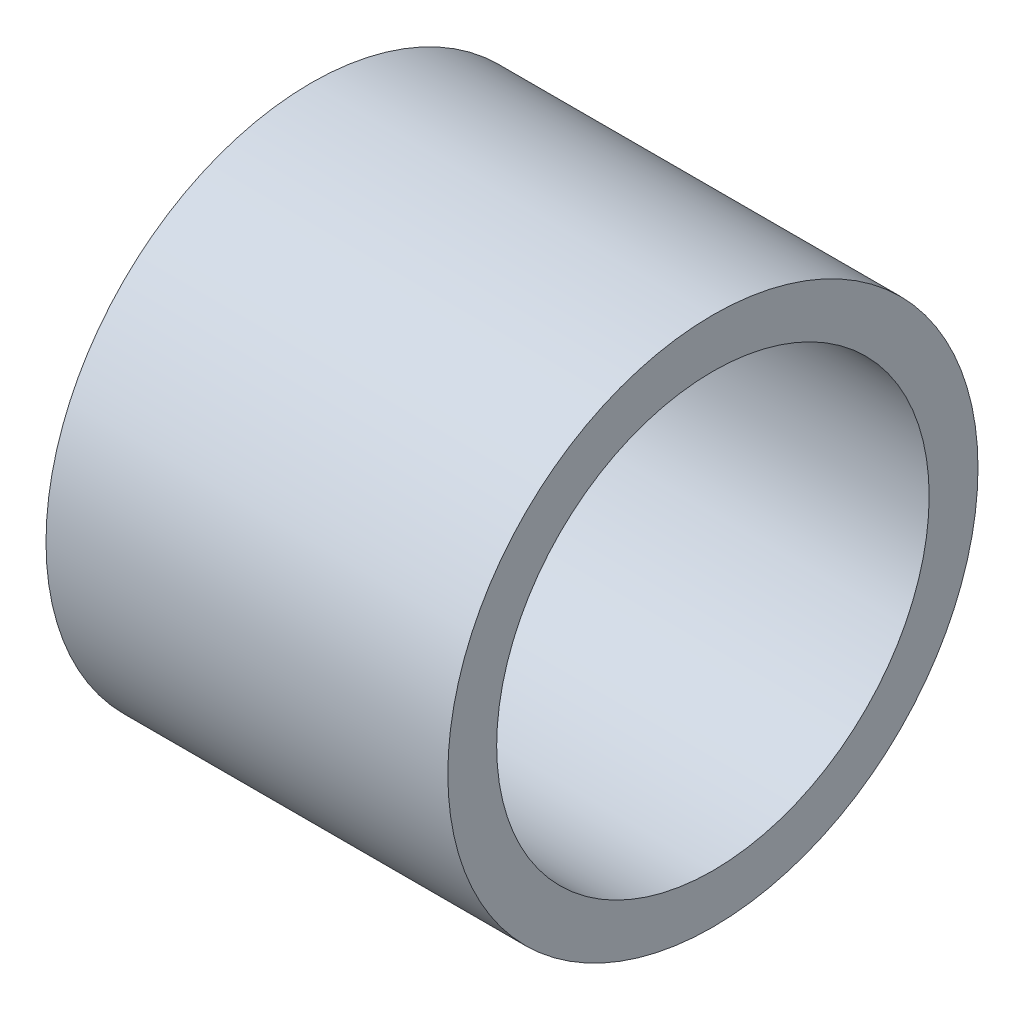
from build123d import *

# Parameters (mm, degrees)
SKETCH1_R           = 9.5
SKETCH1_R_2         = 7.75
BOSS_EXTRUDE1_DEPTH = 7.2


with BuildPart() as part:
    # Sketch1 → Boss-Extrude1 (new, symmetric)
    with BuildSketch(Plane(origin=(0, 0, 0), x_dir=(0, 0, -1), z_dir=(1, 0, 0))):
        Circle(SKETCH1_R)
        Circle(SKETCH1_R_2, mode=Mode.SUBTRACT)
    extrude(amount=BOSS_EXTRUDE1_DEPTH, both=True)


solid = part.part
